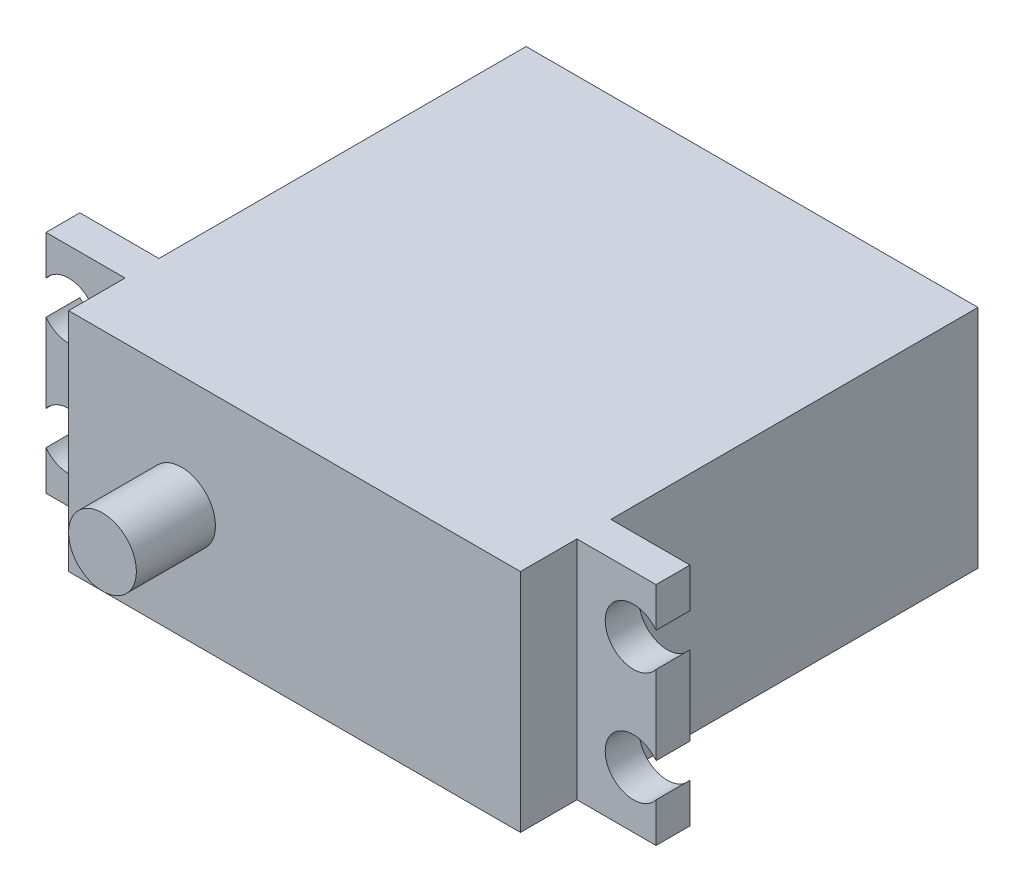
from build123d import *

# Parameters (mm, degrees)
SKETCH_1_W          = 40
SKETCH_1_H          = 20
EXTRUDE_1_DEPTH     = 40.5
SKETCH_2_R          = 3
EXTRUDE_2_DEPTH     = 7
EXTRUDE_START       = -5
SKETCH_3_W          = 7
SKETCH_3_H          = 20
EXTRUDE_3_DEPTH     = 3
SKETCH_4_R          = 2.5
CUT_EXTRUDE_1_DEPTH = 10


with BuildPart() as part:
    # 草图1 → 凸台-拉伸1 (new body)
    with BuildSketch(Plane.XY):
        with Locations((20, -10)):
            Rectangle(SKETCH_1_W, SKETCH_1_H)
    extrude(amount=EXTRUDE_1_DEPTH)

    # 草图2 → 凸台-拉伸2 (add)
    with BuildSketch(Plane.XY.offset(40.5)):
        with Locations((10, -10)):
            Circle(SKETCH_2_R)
    extrude(amount=EXTRUDE_2_DEPTH)

    # 草图3 → 凸台-拉伸3 (add)
    with BuildSketch(Plane.XY.offset(40.5).offset(EXTRUDE_START)):
        with Locations((43.5, -10)):
            Rectangle(SKETCH_3_W, SKETCH_3_H)
        with Locations((-3.5, -10)):
            Rectangle(SKETCH_3_W, SKETCH_3_H)
    extrude(amount=-EXTRUDE_3_DEPTH)

    # 草图4 → 切除-拉伸1 (cut)
    with BuildSketch(Plane.XY.offset(35.5)):
        with Locations((-5, -5)):
            Circle(SKETCH_4_R)
        with Locations((45, -5)):
            Circle(SKETCH_4_R)
        with Locations((-5, -15)):
            Circle(SKETCH_4_R)
        with Locations((45, -15)):
            Circle(SKETCH_4_R)
    extrude(amount=-CUT_EXTRUDE_1_DEPTH, mode=Mode.SUBTRACT)


solid = part.part
